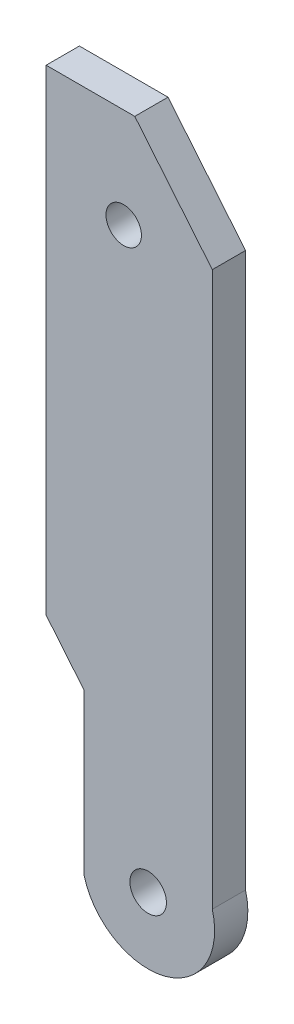
from build123d import *

# Parameters (mm, degrees)
SKETCH1_R           = 1.65
SKETCH1_R_2         = 1.6
BOSS_EXTRUDE1_DEPTH = 3


with BuildPart() as part:
    # Sketch1 → Boss-Extrude1 (new body)
    with BuildSketch(Plane.XY):
        with BuildLine():
            Line((22.650283011, 50.925569007), (22.650283011, 36.440298517))
            ThreePointArc((22.650283011, 36.440298517), (30.012998862, 32.222429945), (34.230867434, 39.585145796))
            Line((34.230867434, 39.585145796), (34.230867434, 89.585145796))
            Line((34.230867434, 89.585145796), (27.230867434, 98.07042717))
            Line((27.230867434, 98.07042717), (19.230867434, 98.07042717))
            Line((19.230867434, 98.07042717), (19.230867434, 55.070526621))
            Line((19.230867434, 55.070526621), (22.650283011, 50.925569007))
        make_face()
        with Locations((28.440575223, 38.012722157)):
            Circle(SKETCH1_R, mode=Mode.SUBTRACT)
        with Locations((26.230867434, 89.07042717)):
            Circle(SKETCH1_R_2, mode=Mode.SUBTRACT)
    extrude(amount=BOSS_EXTRUDE1_DEPTH)


solid = part.part
